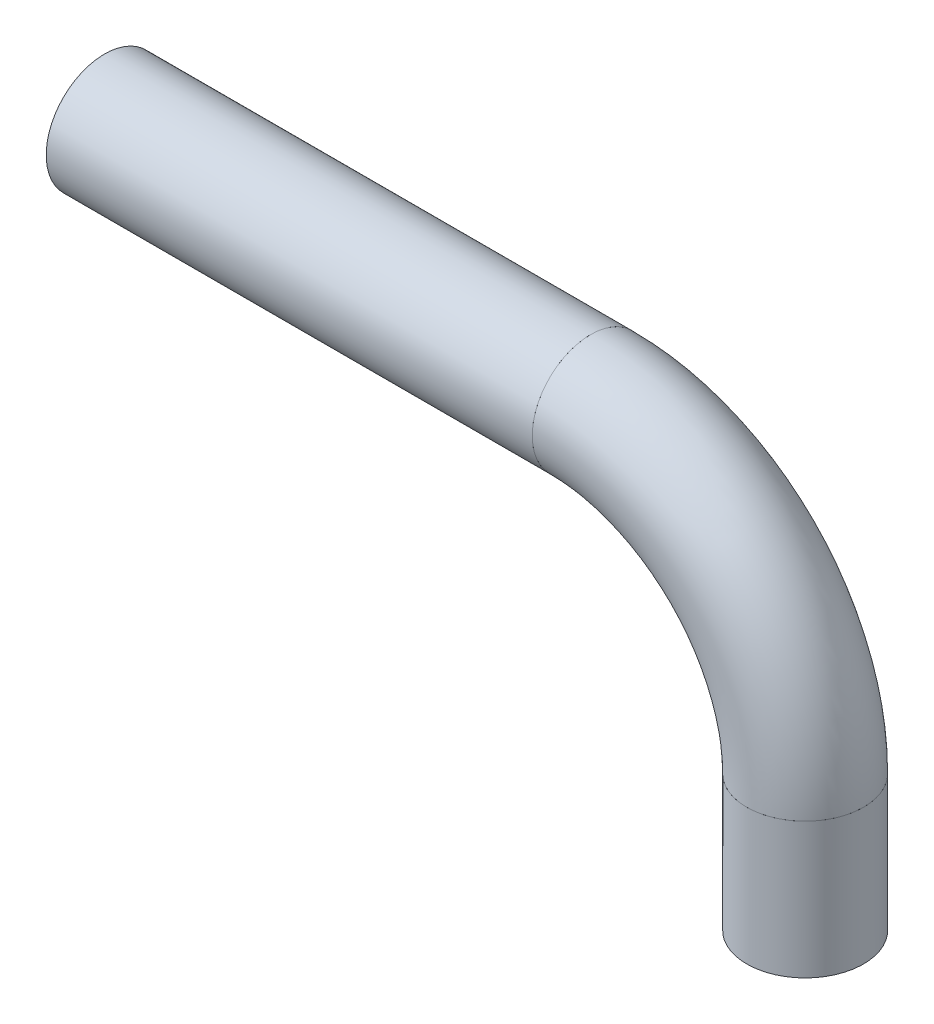
from build123d import *

# Parameters (mm, degrees)
SKETCH14_R                                     = 76.2
SKETCH14_R_2                                   = 63.5
AL_ROUND_TUBING_AL_RND_TUBE_6_OD_X_0_5_W_DEPTH = 634.4
SKETCH14_ON_SEGMENT_2_R                        = 76.2
SKETCH14_ON_SEGMENT_2_R_2                      = 63.5
AL_ROUND_TUBING_AL_RND_TUBE_6_OD_X_0_2_ANGLE   = 90
SKETCH14_ON_SEGMENT_3_R                        = 76.2
SKETCH14_ON_SEGMENT_3_R_2                      = 63.5
AL_ROUND_TUBING_AL_RND_TUBE_6_OD_X_0_3_DEPTH   = 177.2


with BuildPart() as part:
    # Sketch14 → Al round tubing AL RND TUBE 6 OD X 0.5 WALL(1) (new body)
    with BuildSketch(Plane.YZ):
        Circle(SKETCH14_R)
        Circle(SKETCH14_R_2, mode=Mode.SUBTRACT)
    extrude(amount=AL_ROUND_TUBING_AL_RND_TUBE_6_OD_X_0_5_W_DEPTH)


with BuildPart() as body_2:
    # Sketch14 on segment 2 (carried to the start of arc 2) → Al round tubing AL RND TUBE 6 OD X 0 2 (revolve)
    with BuildSketch(Plane(origin=(914.4, -280, 0), x_dir=(-1, 0, 0), z_dir=(0, 1, 0))):
        Circle(SKETCH14_ON_SEGMENT_2_R)
        Circle(SKETCH14_ON_SEGMENT_2_R_2, mode=Mode.SUBTRACT)
    revolve(axis=Axis((634.4, -280, 0), (0, 0, 1)), revolution_arc=AL_ROUND_TUBING_AL_RND_TUBE_6_OD_X_0_2_ANGLE)


with BuildPart() as body_3:
    # Sketch14 on segment 3 (carried to segment 3) → Al round tubing AL RND TUBE 6 OD X 0 3 (new body)
    with BuildSketch(Plane(origin=(914.4, -280, 0), x_dir=(1, 0, 0), z_dir=(0, -1, 0))):
        Circle(SKETCH14_ON_SEGMENT_3_R)
        Circle(SKETCH14_ON_SEGMENT_3_R_2, mode=Mode.SUBTRACT)
    extrude(amount=AL_ROUND_TUBING_AL_RND_TUBE_6_OD_X_0_3_DEPTH)


solid = Compound([part.part, body_2.part, body_3.part])
